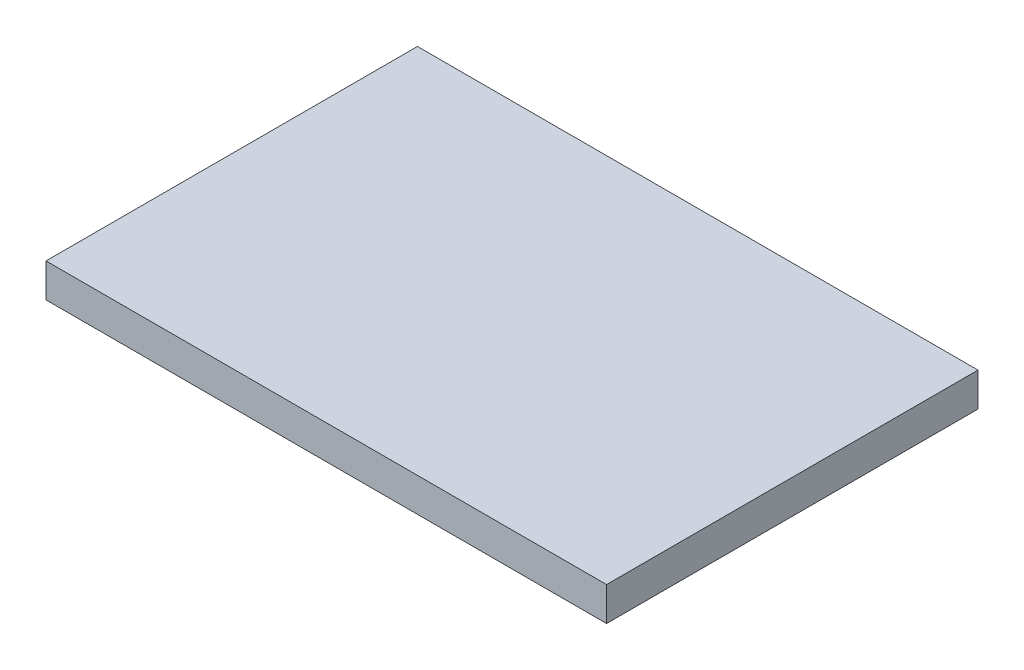
from build123d import *

# Parameters (mm, degrees)
SKETCH1_W           = 83
SKETCH1_H           = 55
BOSS_EXTRUDE1_DEPTH = 5


with BuildPart() as part:
    # Sketch1 → Boss-Extrude1 (new body)
    with BuildSketch(Plane(origin=(0, 0, 0), x_dir=(1, 0, 0), z_dir=(0, 1, 0))):
        Rectangle(SKETCH1_W, SKETCH1_H)
    extrude(amount=BOSS_EXTRUDE1_DEPTH)


solid = part.part
